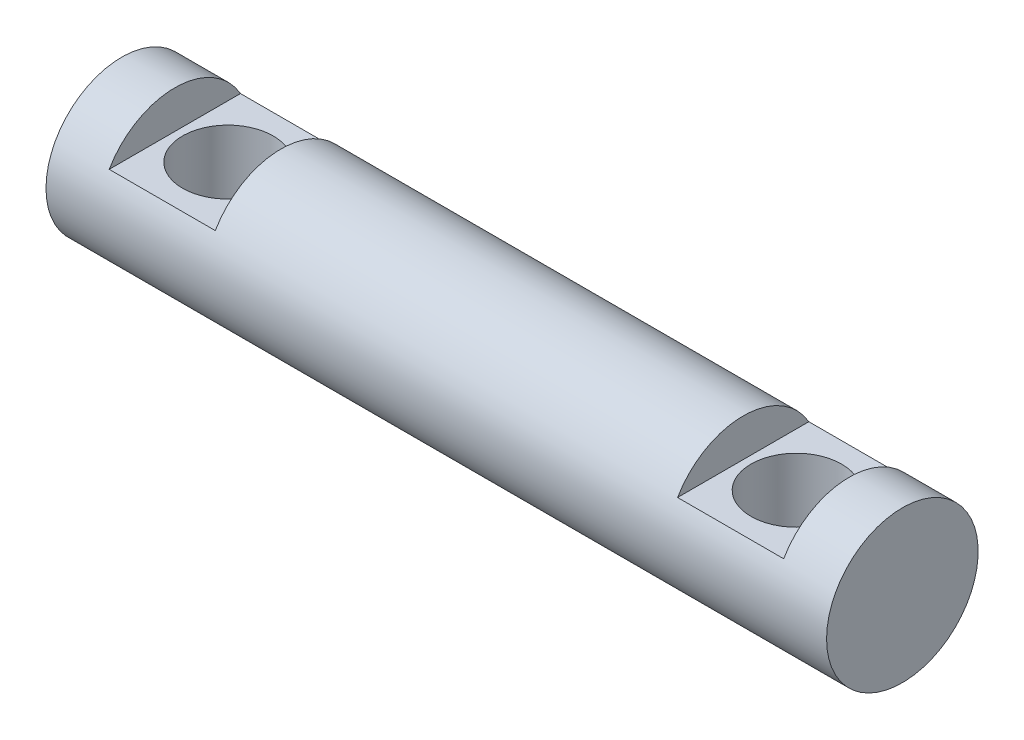
from build123d import *

# Parameters (mm, degrees)
ESQUISSE1_W                  = 103
ESQUISSE1_H                  = 10
ENL_V_MAT_EXTRU_4_DEPTH      = 104.966340707
ENL_V_MAT_EXTRU_4_DEPTH_BACK = 104.966340707
ESQUISSE8_R                  = 5.983
ENL_V_START                  = 5
ESQUISSE9_W                  = 14
ESQUISSE9_H                  = 20
ENL_V_MAT_EXTRU_6_DEPTH      = 99.966340826


with BuildPart() as part:
    # Esquisse1 → Révolution1 (revolve)
    with BuildSketch(Plane.XY, mode=Mode.PRIVATE) as r_volution1_sk:
        with Locations((51.5, 5)):
            Rectangle(ESQUISSE1_W, ESQUISSE1_H)
    revolve(r_volution1_sk.sketch.rotate(Axis((0, 0, 0), (1, 0, 0)), 90), axis=Axis((0, 0, 0), (1, 0, 0)))

    # Esquisse8 → Enlèv. mat.-Extru.4 (cut, two sides: drawn at the far end of the back side and taken through both)
    with BuildSketch(Plane(origin=(0, 0, 0), x_dir=(1, 0, 0), z_dir=(0, 1, 0)).offset(-ENL_V_MAT_EXTRU_4_DEPTH_BACK)):
        with Locations(Location((14, 0, 0), (0, 0, 270))):
            Circle(ESQUISSE8_R)
        with Locations(Location((89, 0, 0), (0, 0, 270))):
            Circle(ESQUISSE8_R)
    extrude(amount=ENL_V_MAT_EXTRU_4_DEPTH + ENL_V_MAT_EXTRU_4_DEPTH_BACK, mode=Mode.SUBTRACT)

    # Esquisse9 → Enlèv. mat.-Extru.6 (cut, through all)
    with BuildSketch(Plane(origin=(0, 0, 0), x_dir=(1, 0, 0), z_dir=(0, 1, 0)).offset(ENL_V_START)):
        with Locations((14, 0)):
            Rectangle(ESQUISSE9_W, ESQUISSE9_H)
        with Locations((89, 0)):
            Rectangle(ESQUISSE9_W, ESQUISSE9_H)
    extrude(amount=ENL_V_MAT_EXTRU_6_DEPTH, mode=Mode.SUBTRACT)


solid = part.part
